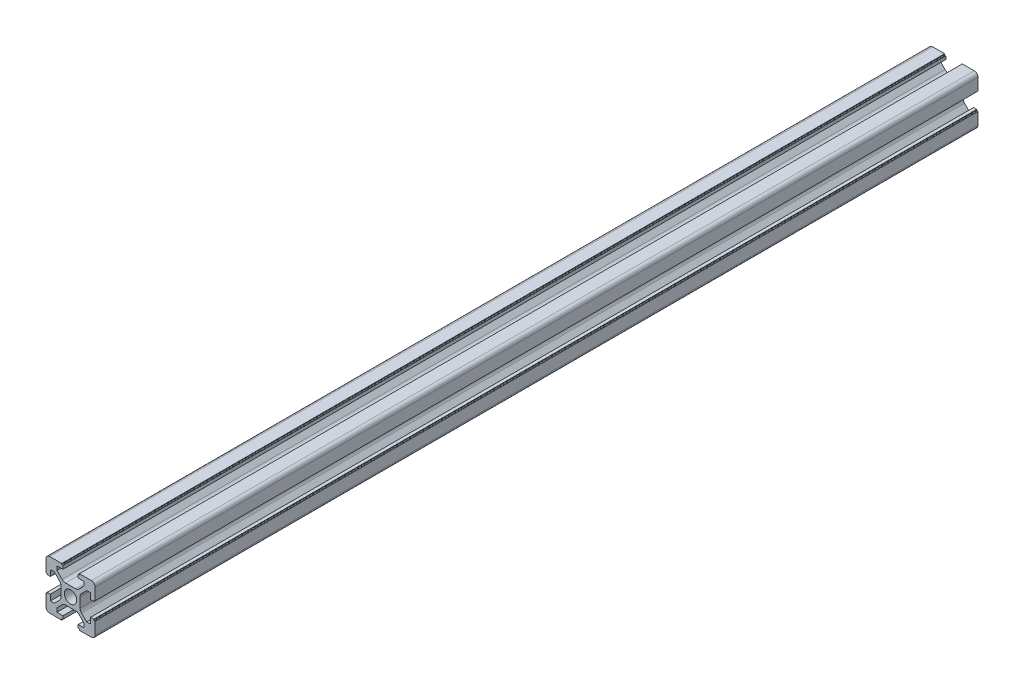
from build123d import *

# Parameters (mm, degrees)
SKETCH1_R      = 2.5
EXTRUDE1_DEPTH = 360


with BuildPart() as part:
    # Sketch1 → Extrude1 (new body)
    with BuildSketch(Plane.XY):
        with BuildLine():
            Line((0, 3.9), (-2.010912703, 3.9))
            ThreePointArc((-2.010912703, 3.9), (-2.776279568, 4.052240935), (-3.425126266, 4.485786438))
            Line((-3.425126266, 4.485786438), (-5.539339828, 6.6))
            Line((-5.539339828, 6.6), (-5.539339828, 8.2))
            Line((-5.539339828, 8.2), (-3.1, 8.2))
            Line((-3.1, 8.2), (-3.1, 9.5))
            Line((-3.1, 9.5), (-3.4, 9.5))
            ThreePointArc((-3.4, 9.5), (-3.541421356, 9.558578644), (-3.6, 9.7))
            Line((-3.6, 9.7), (-3.6, 10))
            Line((-3.6, 10), (-8.5, 10))
            ThreePointArc((-8.5, 10), (-9.560660172, 9.560660172), (-10, 8.5))
            Line((-10, 8.5), (-10, 3.6))
            Line((-10, 3.6), (-9.7, 3.6))
            ThreePointArc((-9.7, 3.6), (-9.558578644, 3.541421356), (-9.5, 3.4))
            Line((-9.5, 3.4), (-9.5, 3.1))
            Line((-9.5, 3.1), (-8.2, 3.1))
            Line((-8.2, 3.1), (-8.2, 5.539339828))
            Line((-8.2, 5.539339828), (-6.6, 5.539339828))
            Line((-6.6, 5.539339828), (-4.485786438, 3.425126266))
            ThreePointArc((-4.485786438, 3.425126266), (-4.052240935, 2.776279568), (-3.9, 2.010912703))
            Line((-3.9, 2.010912703), (-3.9, 0))
            Line((-3.9, 0), (-3.9, -2.010912703))
            ThreePointArc((-3.9, -2.010912703), (-4.052240935, -2.776279568), (-4.485786438, -3.425126266))
            Line((-4.485786438, -3.425126266), (-6.6, -5.539339828))
            Line((-6.6, -5.539339828), (-8.2, -5.539339828))
            Line((-8.2, -5.539339828), (-8.2, -3.1))
            Line((-8.2, -3.1), (-9.5, -3.1))
            Line((-9.5, -3.1), (-9.5, -3.4))
            ThreePointArc((-9.5, -3.4), (-9.558578644, -3.541421356), (-9.7, -3.6))
            Line((-9.7, -3.6), (-10, -3.6))
            Line((-10, -3.6), (-10, -8.5))
            ThreePointArc((-10, -8.5), (-9.560660172, -9.560660172), (-8.5, -10))
            Line((-8.5, -10), (-3.6, -10))
            Line((-3.6, -10), (-3.6, -9.7))
            ThreePointArc((-3.6, -9.7), (-3.541421356, -9.558578644), (-3.4, -9.5))
            Line((-3.4, -9.5), (-3.1, -9.5))
            Line((-3.1, -9.5), (-3.1, -8.2))
            Line((-3.1, -8.2), (-5.539339828, -8.2))
            Line((-5.539339828, -8.2), (-5.539339828, -6.6))
            Line((-5.539339828, -6.6), (-3.425126266, -4.485786438))
            ThreePointArc((-3.425126266, -4.485786438), (-2.776279568, -4.052240935), (-2.010912703, -3.9))
            Line((-2.010912703, -3.9), (0, -3.9))
            Line((0, -3.9), (2.010912703, -3.9))
            ThreePointArc((2.010912703, -3.9), (2.776279568, -4.052240935), (3.425126266, -4.485786438))
            Line((3.425126266, -4.485786438), (5.539339828, -6.6))
            Line((5.539339828, -6.6), (5.539339828, -8.2))
            Line((5.539339828, -8.2), (3.1, -8.2))
            Line((3.1, -8.2), (3.1, -9.5))
            Line((3.1, -9.5), (3.4, -9.5))
            ThreePointArc((3.4, -9.5), (3.541421356, -9.558578644), (3.6, -9.7))
            Line((3.6, -9.7), (3.6, -10))
            Line((3.6, -10), (8.5, -10))
            ThreePointArc((8.5, -10), (9.560660172, -9.560660172), (10, -8.5))
            Line((10, -8.5), (10, -3.6))
            Line((10, -3.6), (9.7, -3.6))
            ThreePointArc((9.7, -3.6), (9.558578644, -3.541421356), (9.5, -3.4))
            Line((9.5, -3.4), (9.5, -3.1))
            Line((9.5, -3.1), (8.2, -3.1))
            Line((8.2, -3.1), (8.2, -5.539339828))
            Line((8.2, -5.539339828), (6.6, -5.539339828))
            Line((6.6, -5.539339828), (4.485786438, -3.425126266))
            ThreePointArc((4.485786438, -3.425126266), (4.052240935, -2.776279568), (3.9, -2.010912703))
            Line((3.9, -2.010912703), (3.9, 0))
            Line((3.9, 0), (3.9, 2.010912703))
            ThreePointArc((3.9, 2.010912703), (4.052240935, 2.776279568), (4.485786438, 3.425126266))
            Line((4.485786438, 3.425126266), (6.6, 5.539339828))
            Line((6.6, 5.539339828), (8.2, 5.539339828))
            Line((8.2, 5.539339828), (8.2, 3.1))
            Line((8.2, 3.1), (9.5, 3.1))
            Line((9.5, 3.1), (9.5, 3.4))
            ThreePointArc((9.5, 3.4), (9.558578644, 3.541421356), (9.7, 3.6))
            Line((9.7, 3.6), (10, 3.6))
            Line((10, 3.6), (10, 8.5))
            ThreePointArc((10, 8.5), (9.560660172, 9.560660172), (8.5, 10))
            Line((8.5, 10), (3.6, 10))
            Line((3.6, 10), (3.6, 9.7))
            ThreePointArc((3.6, 9.7), (3.541421356, 9.558578644), (3.4, 9.5))
            Line((3.4, 9.5), (3.1, 9.5))
            Line((3.1, 9.5), (3.1, 8.2))
            Line((3.1, 8.2), (5.539339828, 8.2))
            Line((5.539339828, 8.2), (5.539339828, 6.6))
            Line((5.539339828, 6.6), (3.425126266, 4.485786438))
            ThreePointArc((3.425126266, 4.485786438), (2.776279568, 4.052240935), (2.010912703, 3.9))
            Line((2.010912703, 3.9), (0, 3.9))
        make_face()
        with Locations(Location((0, 0, 0), (0, 0, 180))):
            Circle(SKETCH1_R, mode=Mode.SUBTRACT)
    extrude(amount=EXTRUDE1_DEPTH)


solid = part.part
